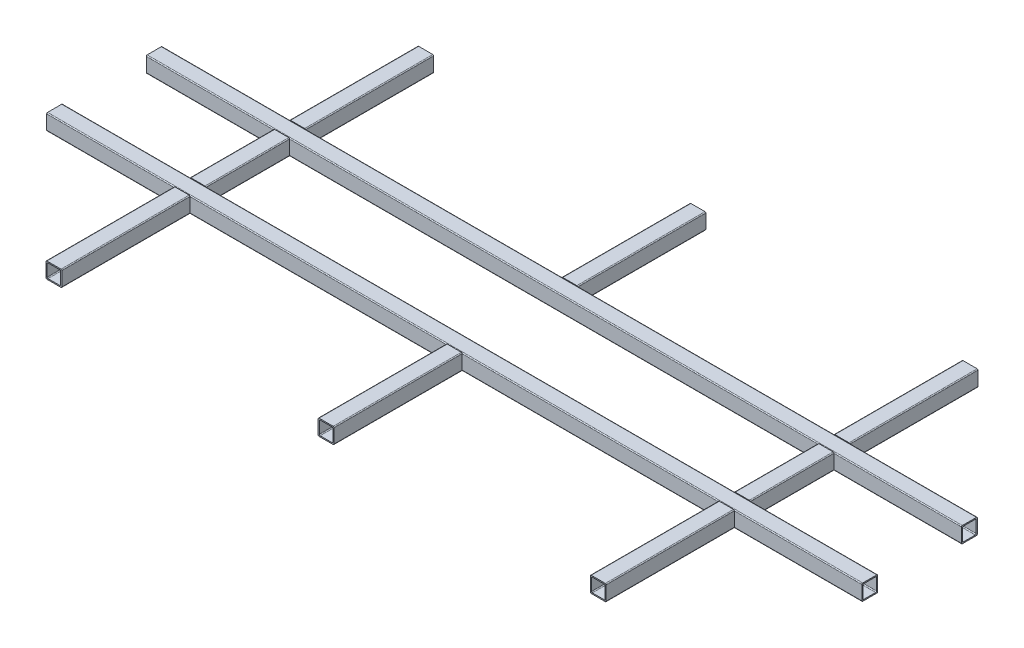
from build123d import *

# Parameters (mm, degrees)
CUSTOM_TUBE_CARRE_35_2_5_1_DEPTH   = 1800
CUSTOM_TUBE_CARRE_35_2_5_1_2_DEPTH = 1800
CUSTOM_TUBE_CARRE_35_2_5_4_DEPTH   = 300.5
CUSTOM_TUBE_CARRE_35_2_5_4_2_DEPTH = 300.5
CUSTOM_TUBE_CARRE_35_2_5_4_3_DEPTH = 220
CUSTOM_TUBE_CARRE_35_2_5_4_4_DEPTH = 300.5
CUSTOM_TUBE_CARRE_35_2_5_4_5_DEPTH = 300.5
CUSTOM_TUBE_CARRE_35_2_5_4_6_DEPTH = 300.5
CUSTOM_TUBE_CARRE_35_2_5_4_7_DEPTH = 220
CUSTOM_TUBE_CARRE_35_2_5_4_8_DEPTH = 300.5


with BuildPart() as part:
    # Esquisse14 → Custom TUBE-CARRE-35-2.5(1) (new body)
    with BuildSketch(Plane(origin=(-900, 0, -110), x_dir=(0, 0, -1), z_dir=(1, 0, 0))):
        with BuildLine():
            Line((-15.5, -17.5), (15.5, -17.5))
            ThreePointArc((15.5, -17.5), (16.914213562, -16.914213562), (17.5, -15.5))
            Line((17.5, -15.5), (17.5, 15.5))
            ThreePointArc((17.5, 15.5), (16.914213562, 16.914213562), (15.5, 17.5))
            Line((15.5, 17.5), (-15.5, 17.5))
            ThreePointArc((-15.5, 17.5), (-16.914213562, 16.914213562), (-17.5, 15.5))
            Line((-17.5, 15.5), (-17.5, -15.5))
            ThreePointArc((-17.5, -15.5), (-16.914213562, -16.914213562), (-15.5, -17.5))
        make_face()
        with BuildLine():
            Line((-13, -15), (13, -15))
            ThreePointArc((13, -15), (14.414213562, -14.414213562), (15, -13))
            Line((15, -13), (15, 13))
            ThreePointArc((15, 13), (14.414213562, 14.414213562), (13, 15))
            Line((13, 15), (-13, 15))
            ThreePointArc((-13, 15), (-14.414213562, 14.414213562), (-15, 13))
            Line((-15, 13), (-15, -13))
            ThreePointArc((-15, -13), (-14.414213562, -14.414213562), (-13, -15))
        make_face(mode=Mode.SUBTRACT)
    extrude(amount=CUSTOM_TUBE_CARRE_35_2_5_1_DEPTH)


with BuildPart() as body_2:
    # Esquisse14 on segment 2 (carried to segment 2) → Custom TUBE-CARRE-35-2.5_1 2 (new body)
    with BuildSketch(Plane(origin=(-900, 0, 110), x_dir=(0, 0, -1), z_dir=(1, 0, 0))):
        with BuildLine():
            Line((-15.5, -17.5), (15.5, -17.5))
            ThreePointArc((15.5, -17.5), (16.914213562, -16.914213562), (17.5, -15.5))
            Line((17.5, -15.5), (17.5, 15.5))
            ThreePointArc((17.5, 15.5), (16.914213562, 16.914213562), (15.5, 17.5))
            Line((15.5, 17.5), (-15.5, 17.5))
            ThreePointArc((-15.5, 17.5), (-16.914213562, 16.914213562), (-17.5, 15.5))
            Line((-17.5, 15.5), (-17.5, -15.5))
            ThreePointArc((-17.5, -15.5), (-16.914213562, -16.914213562), (-15.5, -17.5))
        make_face()
        with BuildLine():
            Line((-13, -15), (13, -15))
            ThreePointArc((13, -15), (14.414213562, -14.414213562), (15, -13))
            Line((15, -13), (15, 13))
            ThreePointArc((15, 13), (14.414213562, 14.414213562), (13, 15))
            Line((13, 15), (-13, 15))
            ThreePointArc((-13, 15), (-14.414213562, 14.414213562), (-15, 13))
            Line((-15, 13), (-15, -13))
            ThreePointArc((-15, -13), (-14.414213562, -14.414213562), (-13, -15))
        make_face(mode=Mode.SUBTRACT)
    extrude(amount=CUSTOM_TUBE_CARRE_35_2_5_1_2_DEPTH)


with BuildPart() as body_3:
    # Esquisse16 → Custom TUBE-CARRE-35-2.5(4) (new body)
    with BuildSketch(Plane(origin=(601, 0, 110), x_dir=(1, 0, 0), z_dir=(0, 0, 1))):
        with BuildLine():
            Line((-15.5, -17.5), (15.5, -17.5))
            ThreePointArc((15.5, -17.5), (16.914213562, -16.914213562), (17.5, -15.5))
            Line((17.5, -15.5), (17.5, 15.5))
            ThreePointArc((17.5, 15.5), (16.914213562, 16.914213562), (15.5, 17.5))
            Line((15.5, 17.5), (-15.5, 17.5))
            ThreePointArc((-15.5, 17.5), (-16.914213562, 16.914213562), (-17.5, 15.5))
            Line((-17.5, 15.5), (-17.5, -15.5))
            ThreePointArc((-17.5, -15.5), (-16.914213562, -16.914213562), (-15.5, -17.5))
        make_face()
        with BuildLine():
            Line((-13, -15), (13, -15))
            ThreePointArc((13, -15), (14.414213562, -14.414213562), (15, -13))
            Line((15, -13), (15, 13))
            ThreePointArc((15, 13), (14.414213562, 14.414213562), (13, 15))
            Line((13, 15), (-13, 15))
            ThreePointArc((-13, 15), (-14.414213562, 14.414213562), (-15, 13))
            Line((-15, 13), (-15, -13))
            ThreePointArc((-15, -13), (-14.414213562, -14.414213562), (-13, -15))
        make_face(mode=Mode.SUBTRACT)
    extrude(amount=CUSTOM_TUBE_CARRE_35_2_5_4_DEPTH)

    # Ajuster_Prolonger4 86
    split(bisect_by=Plane(origin=(0, 0, 127.5), x_dir=(0, -1, 0), z_dir=(0, 0, 1)), keep=Keep.TOP)


with BuildPart() as body_4:
    # Esquisse16 on segment 2 (carried to segment 2) → Custom TUBE-CARRE-35-2.5_4 2 (new body)
    with BuildSketch(Plane.XY.offset(110)):
        with BuildLine():
            Line((-15.5, -17.5), (15.5, -17.5))
            ThreePointArc((15.5, -17.5), (16.914213562, -16.914213562), (17.5, -15.5))
            Line((17.5, -15.5), (17.5, 15.5))
            ThreePointArc((17.5, 15.5), (16.914213562, 16.914213562), (15.5, 17.5))
            Line((15.5, 17.5), (-15.5, 17.5))
            ThreePointArc((-15.5, 17.5), (-16.914213562, 16.914213562), (-17.5, 15.5))
            Line((-17.5, 15.5), (-17.5, -15.5))
            ThreePointArc((-17.5, -15.5), (-16.914213562, -16.914213562), (-15.5, -17.5))
        make_face()
        with BuildLine():
            Line((-13, -15), (13, -15))
            ThreePointArc((13, -15), (14.414213562, -14.414213562), (15, -13))
            Line((15, -13), (15, 13))
            ThreePointArc((15, 13), (14.414213562, 14.414213562), (13, 15))
            Line((13, 15), (-13, 15))
            ThreePointArc((-13, 15), (-14.414213562, 14.414213562), (-15, 13))
            Line((-15, 13), (-15, -13))
            ThreePointArc((-15, -13), (-14.414213562, -14.414213562), (-13, -15))
        make_face(mode=Mode.SUBTRACT)
    extrude(amount=CUSTOM_TUBE_CARRE_35_2_5_4_2_DEPTH)

    # Ajuster_Prolonger4 52
    split(bisect_by=Plane(origin=(0, 0, 127.5), x_dir=(0, -1, 0), z_dir=(0, 0, 1)), keep=Keep.TOP)


with BuildPart() as body_5:
    # Esquisse16 on segment 3 (carried to segment 3) → Custom TUBE-CARRE-35-2.5_4 3 (new body)
    with BuildSketch(Plane(origin=(601, 0, -110), x_dir=(1, 0, 0), z_dir=(0, 0, 1))):
        with BuildLine():
            Line((-15.5, -17.5), (15.5, -17.5))
            ThreePointArc((15.5, -17.5), (16.914213562, -16.914213562), (17.5, -15.5))
            Line((17.5, -15.5), (17.5, 15.5))
            ThreePointArc((17.5, 15.5), (16.914213562, 16.914213562), (15.5, 17.5))
            Line((15.5, 17.5), (-15.5, 17.5))
            ThreePointArc((-15.5, 17.5), (-16.914213562, 16.914213562), (-17.5, 15.5))
            Line((-17.5, 15.5), (-17.5, -15.5))
            ThreePointArc((-17.5, -15.5), (-16.914213562, -16.914213562), (-15.5, -17.5))
        make_face()
        with BuildLine():
            Line((-13, -15), (13, -15))
            ThreePointArc((13, -15), (14.414213562, -14.414213562), (15, -13))
            Line((15, -13), (15, 13))
            ThreePointArc((15, 13), (14.414213562, 14.414213562), (13, 15))
            Line((13, 15), (-13, 15))
            ThreePointArc((-13, 15), (-14.414213562, 14.414213562), (-15, 13))
            Line((-15, 13), (-15, -13))
            ThreePointArc((-15, -13), (-14.414213562, -14.414213562), (-13, -15))
        make_face(mode=Mode.SUBTRACT)
    extrude(amount=CUSTOM_TUBE_CARRE_35_2_5_4_3_DEPTH)

    # Ajuster_Prolonger4 41
    split(bisect_by=Plane(origin=(0, 0, -92.5), x_dir=(0, -1, 0), z_dir=(0, 0, 1)), keep=Keep.TOP)

    # Ajuster_Prolonger4 46
    split(bisect_by=Plane.YX.offset(-92.5), keep=Keep.TOP)


with BuildPart() as body_6:
    # Esquisse16 on segment 4 (carried to segment 4) → Custom TUBE-CARRE-35-2.5_4 4 (new body)
    with BuildSketch(Plane(origin=(601, 0, -410.5), x_dir=(1, 0, 0), z_dir=(0, 0, 1))):
        with BuildLine():
            Line((-15.5, -17.5), (15.5, -17.5))
            ThreePointArc((15.5, -17.5), (16.914213562, -16.914213562), (17.5, -15.5))
            Line((17.5, -15.5), (17.5, 15.5))
            ThreePointArc((17.5, 15.5), (16.914213562, 16.914213562), (15.5, 17.5))
            Line((15.5, 17.5), (-15.5, 17.5))
            ThreePointArc((-15.5, 17.5), (-16.914213562, 16.914213562), (-17.5, 15.5))
            Line((-17.5, 15.5), (-17.5, -15.5))
            ThreePointArc((-17.5, -15.5), (-16.914213562, -16.914213562), (-15.5, -17.5))
        make_face()
        with BuildLine():
            Line((-13, -15), (13, -15))
            ThreePointArc((13, -15), (14.414213562, -14.414213562), (15, -13))
            Line((15, -13), (15, 13))
            ThreePointArc((15, 13), (14.414213562, 14.414213562), (13, 15))
            Line((13, 15), (-13, 15))
            ThreePointArc((-13, 15), (-14.414213562, 14.414213562), (-15, 13))
            Line((-15, 13), (-15, -13))
            ThreePointArc((-15, -13), (-14.414213562, -14.414213562), (-13, -15))
        make_face(mode=Mode.SUBTRACT)
    extrude(amount=CUSTOM_TUBE_CARRE_35_2_5_4_4_DEPTH)

    # Ajuster_Prolonger4 3
    split(bisect_by=Plane.YX.offset(127.5), keep=Keep.TOP)


with BuildPart() as body_7:
    # Esquisse16 on segment 5 (carried to segment 5) → Custom TUBE-CARRE-35-2.5_4 5 (new body)
    with BuildSketch(Plane.XY.offset(-410.5)):
        with BuildLine():
            Line((-15.5, -17.5), (15.5, -17.5))
            ThreePointArc((15.5, -17.5), (16.914213562, -16.914213562), (17.5, -15.5))
            Line((17.5, -15.5), (17.5, 15.5))
            ThreePointArc((17.5, 15.5), (16.914213562, 16.914213562), (15.5, 17.5))
            Line((15.5, 17.5), (-15.5, 17.5))
            ThreePointArc((-15.5, 17.5), (-16.914213562, 16.914213562), (-17.5, 15.5))
            Line((-17.5, 15.5), (-17.5, -15.5))
            ThreePointArc((-17.5, -15.5), (-16.914213562, -16.914213562), (-15.5, -17.5))
        make_face()
        with BuildLine():
            Line((-13, -15), (13, -15))
            ThreePointArc((13, -15), (14.414213562, -14.414213562), (15, -13))
            Line((15, -13), (15, 13))
            ThreePointArc((15, 13), (14.414213562, 14.414213562), (13, 15))
            Line((13, 15), (-13, 15))
            ThreePointArc((-13, 15), (-14.414213562, 14.414213562), (-15, 13))
            Line((-15, 13), (-15, -13))
            ThreePointArc((-15, -13), (-14.414213562, -14.414213562), (-13, -15))
        make_face(mode=Mode.SUBTRACT)
    extrude(amount=CUSTOM_TUBE_CARRE_35_2_5_4_5_DEPTH)

    # Ajuster_Prolonger4 3
    split(bisect_by=Plane.YX.offset(127.5), keep=Keep.TOP)


with BuildPart() as body_8:
    # Esquisse16 on segment 6 (carried to segment 6) → Custom TUBE-CARRE-35-2.5_4 6 (new body)
    with BuildSketch(Plane(origin=(-601, 0, 110), x_dir=(1, 0, 0), z_dir=(0, 0, 1))):
        with BuildLine():
            Line((-15.5, -17.5), (15.5, -17.5))
            ThreePointArc((15.5, -17.5), (16.914213562, -16.914213562), (17.5, -15.5))
            Line((17.5, -15.5), (17.5, 15.5))
            ThreePointArc((17.5, 15.5), (16.914213562, 16.914213562), (15.5, 17.5))
            Line((15.5, 17.5), (-15.5, 17.5))
            ThreePointArc((-15.5, 17.5), (-16.914213562, 16.914213562), (-17.5, 15.5))
            Line((-17.5, 15.5), (-17.5, -15.5))
            ThreePointArc((-17.5, -15.5), (-16.914213562, -16.914213562), (-15.5, -17.5))
        make_face()
        with BuildLine():
            Line((-13, -15), (13, -15))
            ThreePointArc((13, -15), (14.414213562, -14.414213562), (15, -13))
            Line((15, -13), (15, 13))
            ThreePointArc((15, 13), (14.414213562, 14.414213562), (13, 15))
            Line((13, 15), (-13, 15))
            ThreePointArc((-13, 15), (-14.414213562, 14.414213562), (-15, 13))
            Line((-15, 13), (-15, -13))
            ThreePointArc((-15, -13), (-14.414213562, -14.414213562), (-13, -15))
        make_face(mode=Mode.SUBTRACT)
    extrude(amount=CUSTOM_TUBE_CARRE_35_2_5_4_6_DEPTH)

    # Ajuster_Prolonger4 52
    split(bisect_by=Plane(origin=(0, 0, 127.5), x_dir=(0, -1, 0), z_dir=(0, 0, 1)), keep=Keep.TOP)


with BuildPart() as body_9:
    # Esquisse16 on segment 7 (carried to segment 7) → Custom TUBE-CARRE-35-2.5_4 7 (new body)
    with BuildSketch(Plane(origin=(-601, 0, -110), x_dir=(1, 0, 0), z_dir=(0, 0, 1))):
        with BuildLine():
            Line((-15.5, -17.5), (15.5, -17.5))
            ThreePointArc((15.5, -17.5), (16.914213562, -16.914213562), (17.5, -15.5))
            Line((17.5, -15.5), (17.5, 15.5))
            ThreePointArc((17.5, 15.5), (16.914213562, 16.914213562), (15.5, 17.5))
            Line((15.5, 17.5), (-15.5, 17.5))
            ThreePointArc((-15.5, 17.5), (-16.914213562, 16.914213562), (-17.5, 15.5))
            Line((-17.5, 15.5), (-17.5, -15.5))
            ThreePointArc((-17.5, -15.5), (-16.914213562, -16.914213562), (-15.5, -17.5))
        make_face()
        with BuildLine():
            Line((-13, -15), (13, -15))
            ThreePointArc((13, -15), (14.414213562, -14.414213562), (15, -13))
            Line((15, -13), (15, 13))
            ThreePointArc((15, 13), (14.414213562, 14.414213562), (13, 15))
            Line((13, 15), (-13, 15))
            ThreePointArc((-13, 15), (-14.414213562, 14.414213562), (-15, 13))
            Line((-15, 13), (-15, -13))
            ThreePointArc((-15, -13), (-14.414213562, -14.414213562), (-13, -15))
        make_face(mode=Mode.SUBTRACT)
    extrude(amount=CUSTOM_TUBE_CARRE_35_2_5_4_7_DEPTH)

    # Ajuster/Prolonger5
    split(bisect_by=Plane.YX.offset(-92.5), keep=Keep.TOP)

    # Ajuster_Prolonger5 86
    split(bisect_by=Plane(origin=(0, 0, -92.5), x_dir=(0, -1, 0), z_dir=(0, 0, 1)), keep=Keep.TOP)


with BuildPart() as body_10:
    # Esquisse16 on segment 8 (carried to segment 8) → Custom TUBE-CARRE-35-2.5_4 8 (new body)
    with BuildSketch(Plane(origin=(-601, 0, -410.5), x_dir=(1, 0, 0), z_dir=(0, 0, 1))):
        with BuildLine():
            Line((-15.5, -17.5), (15.5, -17.5))
            ThreePointArc((15.5, -17.5), (16.914213562, -16.914213562), (17.5, -15.5))
            Line((17.5, -15.5), (17.5, 15.5))
            ThreePointArc((17.5, 15.5), (16.914213562, 16.914213562), (15.5, 17.5))
            Line((15.5, 17.5), (-15.5, 17.5))
            ThreePointArc((-15.5, 17.5), (-16.914213562, 16.914213562), (-17.5, 15.5))
            Line((-17.5, 15.5), (-17.5, -15.5))
            ThreePointArc((-17.5, -15.5), (-16.914213562, -16.914213562), (-15.5, -17.5))
        make_face()
        with BuildLine():
            Line((-13, -15), (13, -15))
            ThreePointArc((13, -15), (14.414213562, -14.414213562), (15, -13))
            Line((15, -13), (15, 13))
            ThreePointArc((15, 13), (14.414213562, 14.414213562), (13, 15))
            Line((13, 15), (-13, 15))
            ThreePointArc((-13, 15), (-14.414213562, 14.414213562), (-15, 13))
            Line((-15, 13), (-15, -13))
            ThreePointArc((-15, -13), (-14.414213562, -14.414213562), (-13, -15))
        make_face(mode=Mode.SUBTRACT)
    extrude(amount=CUSTOM_TUBE_CARRE_35_2_5_4_8_DEPTH)

    # Ajuster_Prolonger4 3
    split(bisect_by=Plane.YX.offset(127.5), keep=Keep.TOP)


solid = Compound([part.part, body_2.part, body_3.part, body_4.part, body_5.part, body_6.part, body_7.part, body_8.part, body_9.part, body_10.part])
